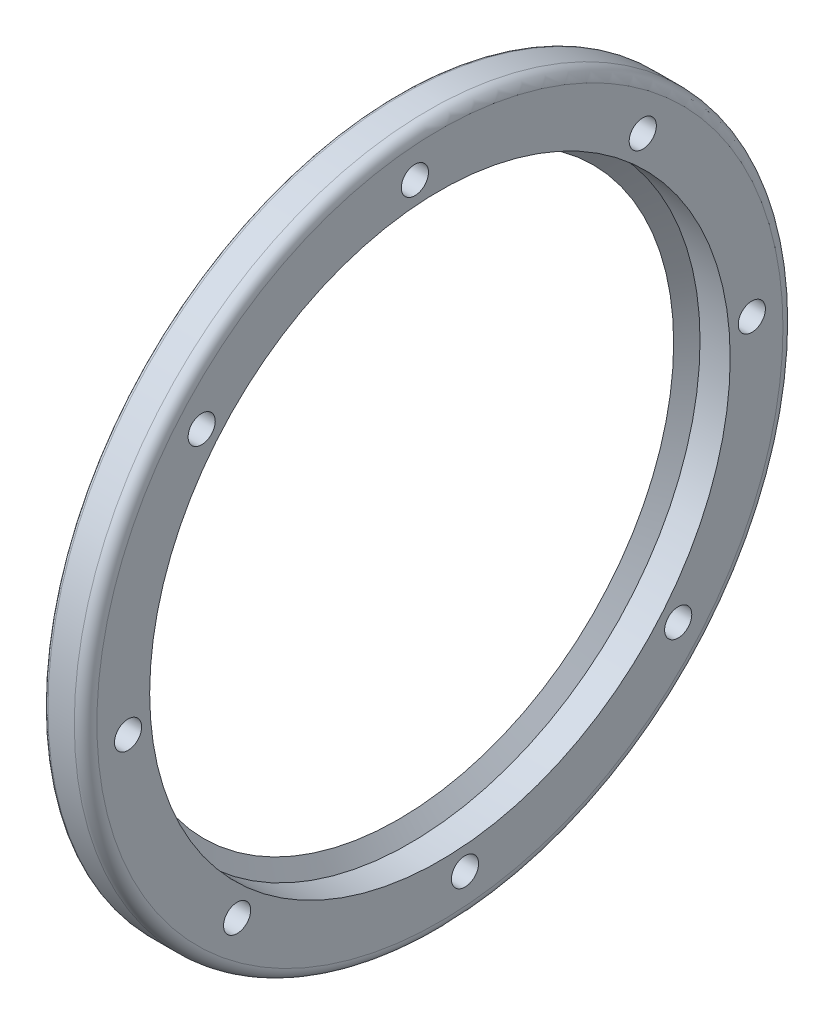
from build123d import *

# Parameters (mm, degrees)
SKETCH1_W         = 5.5
SKETCH1_H         = 6
SKETCH1_H_2       = 2.5
CIRPATTERN1_COUNT = 8
FILLET1_R         = 1.5
FILLET2_R         = 0.5


with BuildPart() as part:
    # Sketch1 → Revolve1 (revolve)
    with BuildSketch(Plane.XY, mode=Mode.PRIVATE) as revolve1_sk:
        with Locations((2.75, -3)):
            Rectangle(SKETCH1_W, SKETCH1_H)
        Polygon((1.5, -6), (0, -6), (0, -8), align=None)
        with Locations((2.75, 1.25)):
            Rectangle(SKETCH1_W, SKETCH1_H_2)
    revolve(revolve1_sk.sketch.rotate(Axis((-1000, -44.5, 0), (1, 0, 0)), 90), axis=Axis((-1000, -44.5, 0), (1, 0, 0)))

    # Sketch6 → M3 Clearance Hole3 (revolve, cut)
    with BuildSketch(Plane(origin=(5.5, -76.100440255, 26.900969791), x_dir=(0, 0, -1), z_dir=(0, 1, 0))):
        Polygon((0, 0), (0, 6.581549114), (1.8, 5.5), (1.8, 0), align=None)
    m3_clearance_hole3 = revolve(axis=Axis((11.85, -76.100440255, 26.900969791), (-1, 0, 0)), mode=Mode.SUBTRACT)

    # CirPattern1: M3 Clearance Hole3 ×8 about axis
    cirpattern1_axis = Axis((0, -44.5, 0), (1, 0, 0))
    for i in range(1, CIRPATTERN1_COUNT):
        add(m3_clearance_hole3.rotate(cirpattern1_axis, i * 360 / CIRPATTERN1_COUNT), mode=Mode.SUBTRACT)

    # Fillet1
    fillet1_edges = [part.edges().sort_by_distance(p)[0] for p in [
        (5.5, -44.5, -47),
    ]]
    fillet(fillet1_edges, radius=FILLET1_R)

    # Fillet2
    fillet2_edges = [part.edges().sort_by_distance(p)[0] for p in [
        (0, -44.5, -47),
    ]]
    fillet(fillet2_edges, radius=FILLET2_R)


solid = part.part
